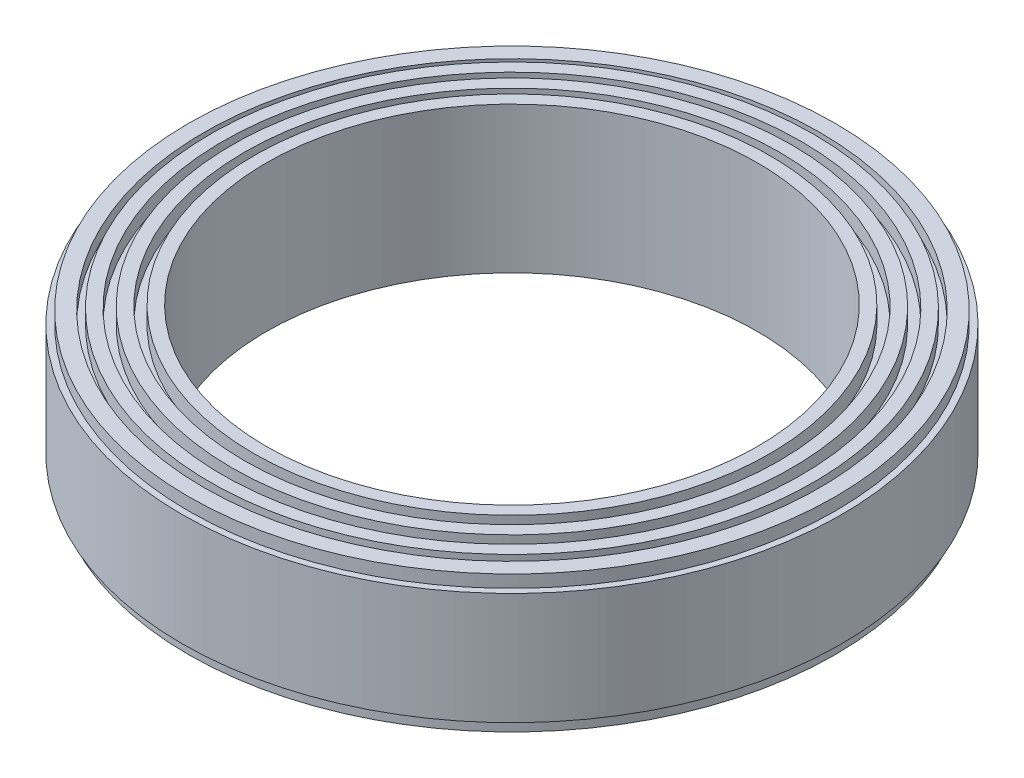
from build123d import *

# Parameters (mm, degrees)
SKETCH1_R                              = 106
SKETCH1_R_2                            = 80
PRESENTATION_TIRE_CASING_ANNULUS_DEPTH = 18
SKETCH2_R                              = 104
SKETCH2_R_2                            = 99
OUTER_TIRE_SHOULDER_LINE_DEPTH         = 22
SKETCH3_R                              = 97
SKETCH3_R_2                            = 93
OUTER_TREAD_GROOVE_LINE_DEPTH          = 22.5
SKETCH4_R                              = 90
SKETCH4_R_2                            = 86
INNER_TREAD_GROOVE_LINE_DEPTH          = 23
SKETCH5_R                              = 83
SKETCH5_R_2                            = 79
INNER_TIRE_BEAD_LINE_DEPTH             = 23.5


with BuildPart() as part:
    # Sketch1 → Presentation tire casing annulus (new, symmetric)
    with BuildSketch(Plane(origin=(0, 0, 0), x_dir=(1, 0, 0), z_dir=(0, 1, 0))):
        with Locations(Location((0, 0, 0), (0, 0, 270))):
            Circle(SKETCH1_R)
        with Locations(Location((0, 0, 0), (0, 0, 270))):
            Circle(SKETCH1_R_2, mode=Mode.SUBTRACT)
    extrude(amount=PRESENTATION_TIRE_CASING_ANNULUS_DEPTH, both=True)

    # Sketch2 → outer tire shoulder line (add, symmetric)
    with BuildSketch(Plane(origin=(0, 0, 0), x_dir=(1, 0, 0), z_dir=(0, 1, 0))):
        with Locations(Location((0, 0, 0), (0, 0, 270))):
            Circle(SKETCH2_R)
        with Locations(Location((0, 0, 0), (0, 0, 270))):
            Circle(SKETCH2_R_2, mode=Mode.SUBTRACT)
    extrude(amount=OUTER_TIRE_SHOULDER_LINE_DEPTH, both=True)

    # Sketch3 → outer tread groove line (add, symmetric)
    with BuildSketch(Plane(origin=(0, 0, 0), x_dir=(1, 0, 0), z_dir=(0, 1, 0))):
        with Locations(Location((0, 0, 0), (0, 0, 90))):
            Circle(SKETCH3_R)
        with Locations(Location((0, 0, 0), (0, 0, 90))):
            Circle(SKETCH3_R_2, mode=Mode.SUBTRACT)
    extrude(amount=OUTER_TREAD_GROOVE_LINE_DEPTH, both=True)

    # Sketch4 → inner tread groove line (add, symmetric)
    with BuildSketch(Plane(origin=(0, 0, 0), x_dir=(1, 0, 0), z_dir=(0, 1, 0))):
        with Locations(Location((0, 0, 0), (0, 0, 270))):
            Circle(SKETCH4_R)
        with Locations(Location((0, 0, 0), (0, 0, 270))):
            Circle(SKETCH4_R_2, mode=Mode.SUBTRACT)
    extrude(amount=INNER_TREAD_GROOVE_LINE_DEPTH, both=True)

    # Sketch5 → inner tire bead line (add, symmetric)
    with BuildSketch(Plane(origin=(0, 0, 0), x_dir=(1, 0, 0), z_dir=(0, 1, 0))):
        with Locations(Location((0, 0, 0), (0, 0, 270))):
            Circle(SKETCH5_R)
        with Locations(Location((0, 0, 0), (0, 0, 270))):
            Circle(SKETCH5_R_2, mode=Mode.SUBTRACT)
    extrude(amount=INNER_TIRE_BEAD_LINE_DEPTH, both=True)


solid = part.part
